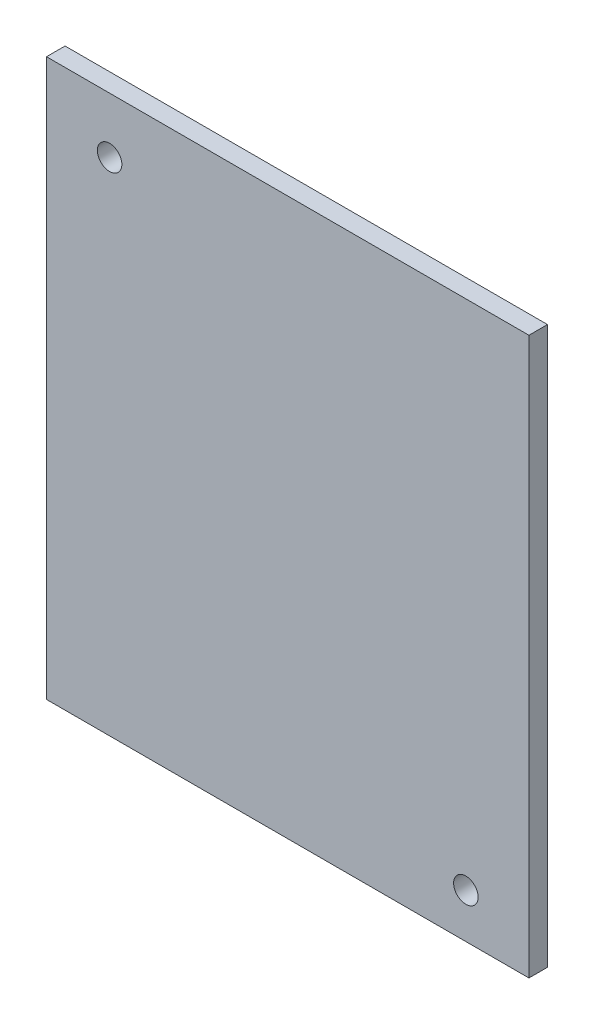
from build123d import *

# Parameters (mm, degrees)
SKETCH1_W           = 65
SKETCH1_H           = 75
SKETCH1_R           = 1.65
BOSS_EXTRUDE1_DEPTH = 2.5


with BuildPart() as part:
    # Sketch1 → Boss-Extrude1 (new body)
    with BuildSketch(Plane.XY):
        with Locations((0, 117.978654182)):
            Rectangle(SKETCH1_W, SKETCH1_H)
        with Locations((-24, 147.978654182)):
            Circle(SKETCH1_R, mode=Mode.SUBTRACT)
        with Locations((24, 86.478654182)):
            Circle(SKETCH1_R, mode=Mode.SUBTRACT)
    extrude(amount=BOSS_EXTRUDE1_DEPTH)


solid = part.part
